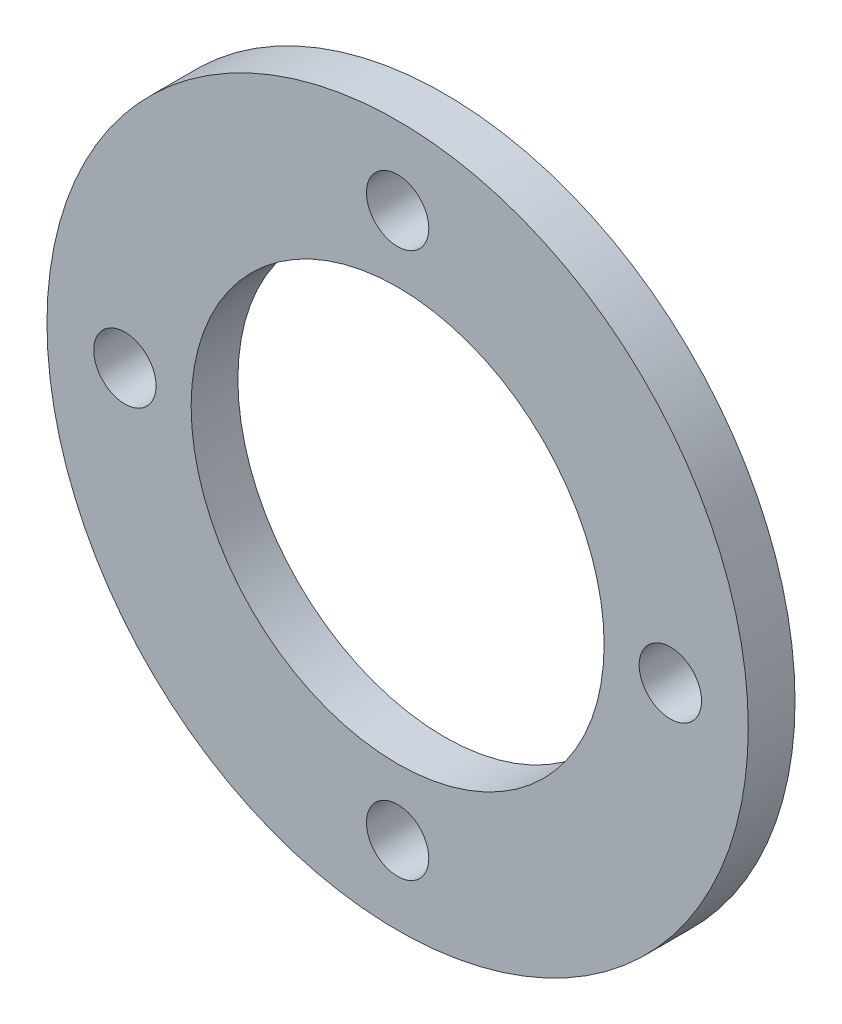
from build123d import *

# Parameters (mm, degrees)
SKETCH_1_R      = 22.5
SKETCH_1_R_2    = 13.25
SKETCH_1_R_3    = 2
EXTRUDE_1_DEPTH = 3


with BuildPart() as part:
    # 草图1 → 凸台-拉伸1 (new body)
    with BuildSketch(Plane.XY):
        Circle(SKETCH_1_R)
        Circle(SKETCH_1_R_2, mode=Mode.SUBTRACT)
        with Locations((0, 17.5)):
            Circle(SKETCH_1_R_3, mode=Mode.SUBTRACT)
        with Locations((-17.5, 0)):
            Circle(SKETCH_1_R_3, mode=Mode.SUBTRACT)
        with Locations((0, -17.5)):
            Circle(SKETCH_1_R_3, mode=Mode.SUBTRACT)
        with Locations((17.5, 0)):
            Circle(SKETCH_1_R_3, mode=Mode.SUBTRACT)
    extrude(amount=EXTRUDE_1_DEPTH)


solid = part.part
